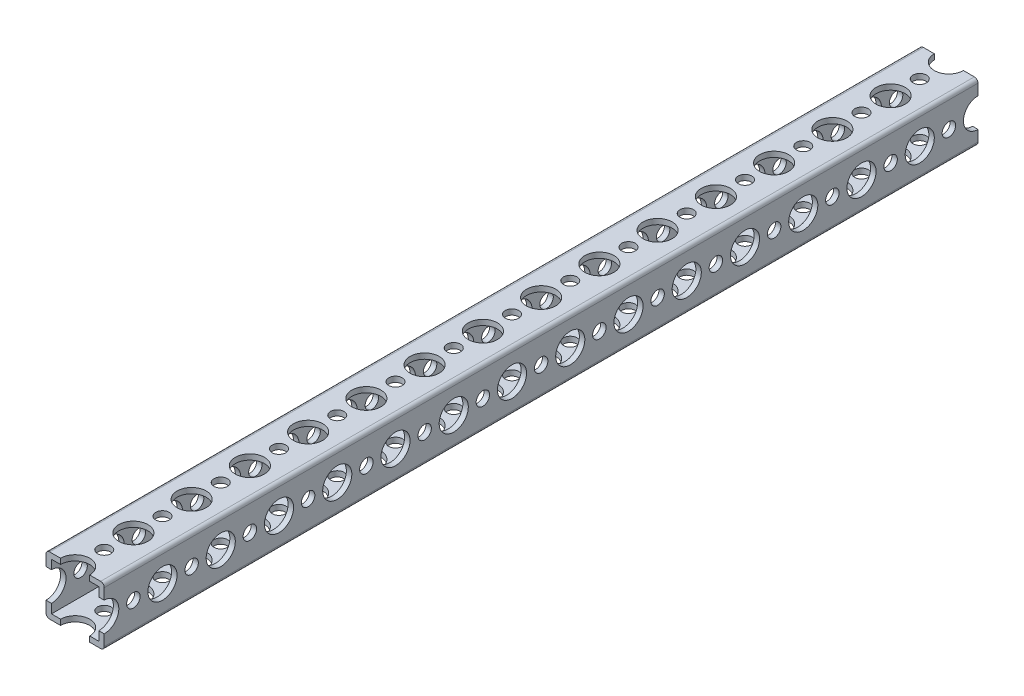
from build123d import *

# Parameters (mm, degrees)
SKETCH1_W      = 16
SKETCH1_H      = 16
EXTRUDE1_DEPTH = 240
SKETCH2_W      = 13
SKETCH2_H      = 13
EXTRUDE2_DEPTH = 242.064306773
SKETCH3_R      = 4
SKETCH3_R_2    = 1.85
EXTRUDE3_DEPTH = 242.064306773
SKETCH4_R      = 4
SKETCH4_R_2    = 1.85
EXTRUDE4_DEPTH = 242.064306773
FILLET1_R      = 1


with BuildPart() as part:
    # Sketch1 → Extrude1 (new body)
    with BuildSketch(Plane.XY):
        with Locations((8, 8)):
            Rectangle(SKETCH1_W, SKETCH1_H)
    extrude(amount=-EXTRUDE1_DEPTH)

    # Sketch2 → Extrude2 (cut, through all)
    with BuildSketch(Plane.XY):
        with Locations((8, 8)):
            Rectangle(SKETCH2_W, SKETCH2_H)
    extrude(amount=-EXTRUDE2_DEPTH, mode=Mode.SUBTRACT)

    # Sketch3 → Extrude3 (cut, through all)
    with BuildSketch(Plane(origin=(0, 16, 0), x_dir=(1, 0, 0), z_dir=(0, 1, 0))):
        with Locations(Location((8, 64, 0), (0, 0, 270))):
            Circle(SKETCH3_R)
        with Locations(Location((8, 32, 0), (0, 0, 270))):
            Circle(SKETCH3_R)
        with Locations((8, 0)):
            Circle(SKETCH3_R)
        with Locations(Location((8, 96, 0), (0, 0, 270))):
            Circle(SKETCH3_R)
        with Locations(Location((8, 128, 0), (0, 0, 270))):
            Circle(SKETCH3_R)
        with Locations(Location((8, 160, 0), (0, 0, 270))):
            Circle(SKETCH3_R)
        with Locations(Location((8, 192, 0), (0, 0, 270))):
            Circle(SKETCH3_R)
        with Locations(Location((8, 224, 0), (0, 0, 270))):
            Circle(SKETCH3_R)
        with Locations((8, 256)):
            Circle(SKETCH3_R)
        with Locations(Location((8, 48, 0), (0, 0, 270))):
            Circle(SKETCH3_R)
        with Locations(Location((8, 56, 0), (0, 0, 270))):
            Circle(SKETCH3_R_2)
        with Locations(Location((8, 40, 0), (0, 0, 270))):
            Circle(SKETCH3_R_2)
        with Locations(Location((8, 80, 0), (0, 0, 270))):
            Circle(SKETCH3_R)
        with Locations(Location((8, 88, 0), (0, 0, 270))):
            Circle(SKETCH3_R_2)
        with Locations(Location((8, 72, 0), (0, 0, 270))):
            Circle(SKETCH3_R_2)
        with Locations(Location((8, 16, 0), (0, 0, 270))):
            Circle(SKETCH3_R)
        with Locations(Location((8, 24, 0), (0, 0, 270))):
            Circle(SKETCH3_R_2)
        with Locations(Location((8, 8, 0), (0, 0, 270))):
            Circle(SKETCH3_R_2)
        with Locations(Location((8, 112, 0), (0, 0, 270))):
            Circle(SKETCH3_R)
        with Locations(Location((8, 120, 0), (0, 0, 270))):
            Circle(SKETCH3_R_2)
        with Locations(Location((8, 104, 0), (0, 0, 270))):
            Circle(SKETCH3_R_2)
        with Locations(Location((8, 144, 0), (0, 0, 270))):
            Circle(SKETCH3_R)
        with Locations(Location((8, 152, 0), (0, 0, 270))):
            Circle(SKETCH3_R_2)
        with Locations(Location((8, 136, 0), (0, 0, 270))):
            Circle(SKETCH3_R_2)
        with Locations(Location((8, 176, 0), (0, 0, 270))):
            Circle(SKETCH3_R)
        with Locations(Location((8, 184, 0), (0, 0, 270))):
            Circle(SKETCH3_R_2)
        with Locations(Location((8, 168, 0), (0, 0, 270))):
            Circle(SKETCH3_R_2)
        with Locations(Location((8, 208, 0), (0, 0, 270))):
            Circle(SKETCH3_R)
        with Locations(Location((8, 216, 0), (0, 0, 270))):
            Circle(SKETCH3_R_2)
        with Locations(Location((8, 200, 0), (0, 0, 270))):
            Circle(SKETCH3_R_2)
        with Locations((8, 240)):
            Circle(SKETCH3_R)
        with Locations((8, 248)):
            Circle(SKETCH3_R_2)
        with Locations(Location((8, 232, 0), (0, 0, 270))):
            Circle(SKETCH3_R_2)
    extrude(amount=-EXTRUDE3_DEPTH, mode=Mode.SUBTRACT)

    # Sketch4 → Extrude4 (cut, through all)
    with BuildSketch(Plane(origin=(16, 0, 0), x_dir=(0, 0, -1), z_dir=(1, 0, 0))):
        with Locations(Location((32, 8, 0), (0, 0, 90))):
            Circle(SKETCH4_R)
        with Locations(Location((64, 8, 0), (0, 0, 90))):
            Circle(SKETCH4_R)
        with Locations((0, 8)):
            Circle(SKETCH4_R)
        with Locations(Location((96, 8, 0), (0, 0, 90))):
            Circle(SKETCH4_R)
        with Locations(Location((128, 8, 0), (0, 0, 90))):
            Circle(SKETCH4_R)
        with Locations(Location((160, 8, 0), (0, 0, 90))):
            Circle(SKETCH4_R)
        with Locations(Location((192, 8, 0), (0, 0, 90))):
            Circle(SKETCH4_R)
        with Locations(Location((224, 8, 0), (0, 0, 90))):
            Circle(SKETCH4_R)
        with Locations((256, 8)):
            Circle(SKETCH4_R)
        with Locations(Location((48, 8.074203, 0), (0, 0, 90))):
            Circle(SKETCH4_R)
        with Locations(Location((40, 8.074203, 0), (0, 0, 90))):
            Circle(SKETCH4_R_2)
        with Locations(Location((56, 8.074203, 0), (0, 0, 90))):
            Circle(SKETCH4_R_2)
        with Locations(Location((80, 8, 0), (0, 0, 90))):
            Circle(SKETCH4_R)
        with Locations(Location((72, 8, 0), (0, 0, 90))):
            Circle(SKETCH4_R_2)
        with Locations(Location((88, 8, 0), (0, 0, 90))):
            Circle(SKETCH4_R_2)
        with Locations(Location((16, 8, 0), (0, 0, 90))):
            Circle(SKETCH4_R)
        with Locations(Location((8, 8, 0), (0, 0, 90))):
            Circle(SKETCH4_R_2)
        with Locations(Location((24, 8, 0), (0, 0, 90))):
            Circle(SKETCH4_R_2)
        with Locations(Location((112, 8, 0), (0, 0, 90))):
            Circle(SKETCH4_R)
        with Locations(Location((104, 8, 0), (0, 0, 90))):
            Circle(SKETCH4_R_2)
        with Locations(Location((120, 8, 0), (0, 0, 90))):
            Circle(SKETCH4_R_2)
        with Locations(Location((144, 8, 0), (0, 0, 90))):
            Circle(SKETCH4_R)
        with Locations(Location((136, 8, 0), (0, 0, 90))):
            Circle(SKETCH4_R_2)
        with Locations(Location((152, 8, 0), (0, 0, 90))):
            Circle(SKETCH4_R_2)
        with Locations(Location((176, 8, 0), (0, 0, 90))):
            Circle(SKETCH4_R)
        with Locations(Location((168, 8, 0), (0, 0, 90))):
            Circle(SKETCH4_R_2)
        with Locations(Location((184, 8, 0), (0, 0, 90))):
            Circle(SKETCH4_R_2)
        with Locations(Location((208, 8, 0), (0, 0, 90))):
            Circle(SKETCH4_R)
        with Locations(Location((200, 8, 0), (0, 0, 90))):
            Circle(SKETCH4_R_2)
        with Locations(Location((216, 8, 0), (0, 0, 90))):
            Circle(SKETCH4_R_2)
        with Locations((240, 8)):
            Circle(SKETCH4_R)
        with Locations(Location((232, 8, 0), (0, 0, 90))):
            Circle(SKETCH4_R_2)
        with Locations((248, 8)):
            Circle(SKETCH4_R_2)
    extrude(amount=-EXTRUDE4_DEPTH, mode=Mode.SUBTRACT)

    # Fillet1
    fillet1_edges = [part.edges().sort_by_distance(p)[0] for p in [
        (0, 16, -120),
        (16, 16, -120),
        (16, 0, -120),
        (0, 0, -120),
    ]]
    fillet(fillet1_edges, radius=FILLET1_R)


solid = part.part
